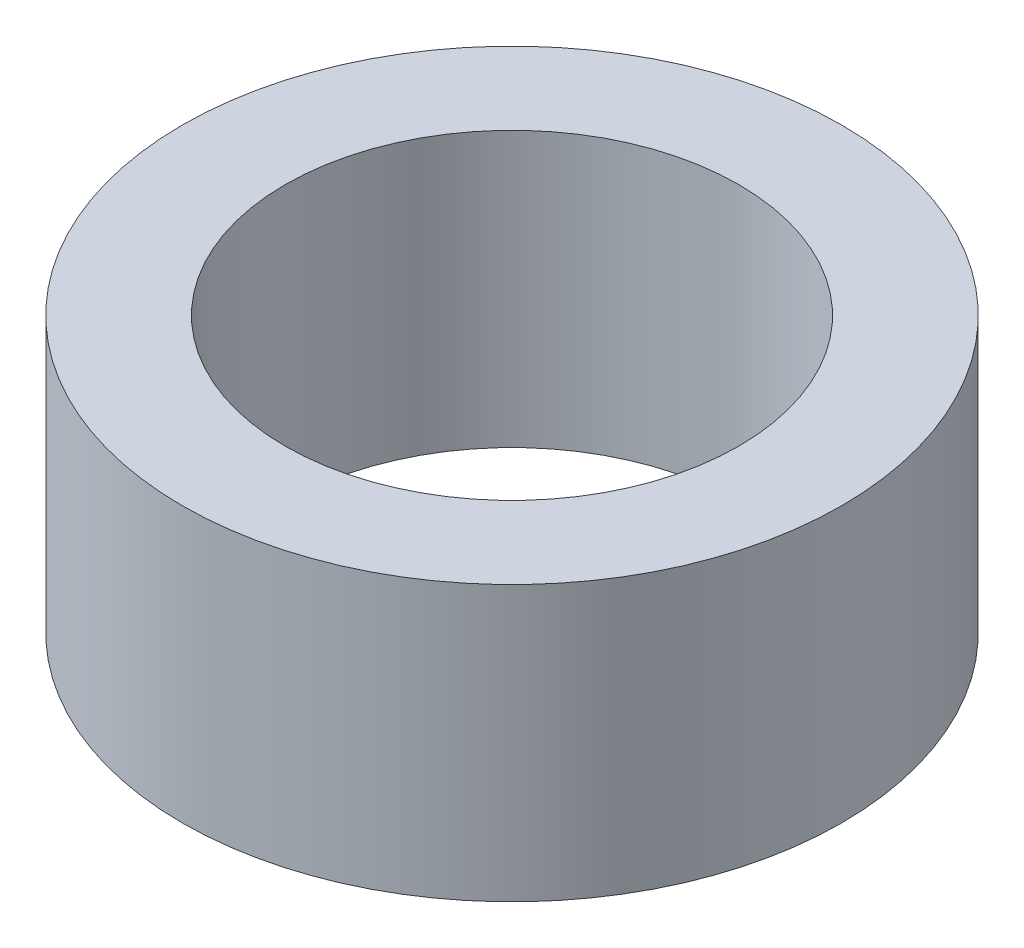
from build123d import *

# Parameters (mm, degrees)
SKETCH_1_R      = 2.4
SKETCH_1_R_2    = 1.65
EXTRUDE_1_DEPTH = 2


with BuildPart() as part:
    # 草图1 → 凸台-拉伸1 (new body)
    with BuildSketch(Plane(origin=(0, 0, 0), x_dir=(1, 0, 0), z_dir=(0, 1, 0))):
        with Locations(Location((0, 0, 0), (0, 0, 270))):
            Circle(SKETCH_1_R)
        with Locations(Location((0, 0, 0), (0, 0, 270))):
            Circle(SKETCH_1_R_2, mode=Mode.SUBTRACT)
    extrude(amount=EXTRUDE_1_DEPTH)


solid = part.part
